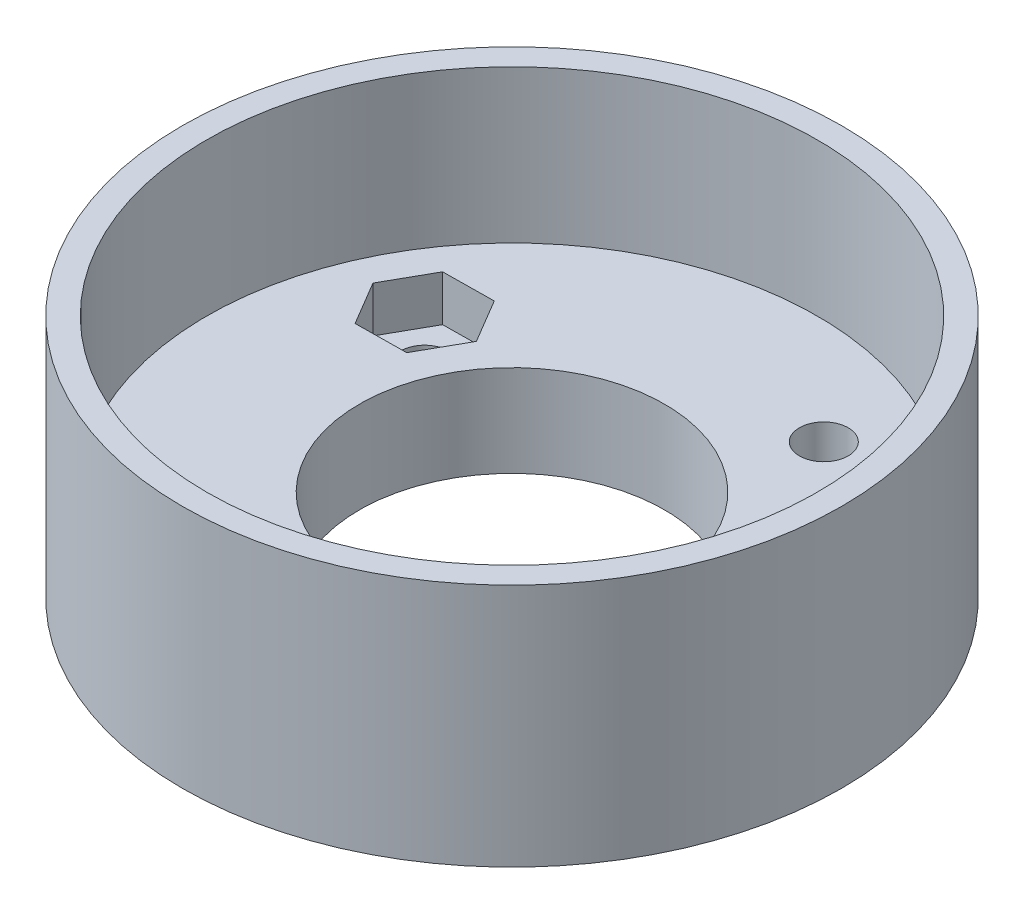
from build123d import *

# Parameters (mm, degrees)
SKETCH1_R           = 21.6
SKETCH1_R_2         = 20
BOSS_EXTRUDE1_DEPTH = 10
BOSS_EXTRUDE2_START = -6
SKETCH1_3_R         = 21.6
SKETCH1_3_R_2       = 20
SKETCH1_3_R_3       = 10
SKETCH1_3_R_4       = 1.6
BOSS_EXTRUDE2_DEPTH = 6
SKETCH1_5_R         = 1.6
CUT_EXTRUDE2_DEPTH  = 33.14218412
CUT_EXTRUDE1_START  = -6
CUT_EXTRUDE1_DEPTH  = 3
BOSS_EXTRUDE3_START = -2.8
SKETCH1_6_R         = 1.6
BOSS_EXTRUDE3_DEPTH = 0.2
CIRPATTERN2_COUNT   = 2
SKETCH3_R           = 1.6
CUT_EXTRUDE4_DEPTH  = 33.14218412
SKETCH3_3_R         = 1.6
CUT_EXTRUDE5_DEPTH  = 3
CIRPATTERN3_COUNT   = 2


with BuildPart() as part:
    # Sketch1 → Boss-Extrude1 (new body)
    with BuildSketch(Plane(origin=(0, 0, 0), x_dir=(1, 0, 0), z_dir=(0, 1, 0))):
        with Locations(Location((0, 0, 0), (0, 0, 270))):
            Circle(SKETCH1_R)
        with Locations(Location((0, 0, 0), (0, 0, 270))):
            Circle(SKETCH1_R_2, mode=Mode.SUBTRACT)
    extrude(amount=BOSS_EXTRUDE1_DEPTH)

    # Sketch1<3> → Boss-Extrude2 (add)
    # profile 1 of 4: a face of its own
    with BuildSketch(Plane(origin=(0, 0, 0), x_dir=(1, 0, 0), z_dir=(0, 1, 0)).offset(BOSS_EXTRUDE2_START)):
        with Locations(Location((0, 0, 0), (0, 0, 270))):
            Circle(SKETCH1_3_R)
        with Locations(Location((0, 0, 0), (0, 0, 270))):
            Circle(SKETCH1_3_R_2, mode=Mode.SUBTRACT)
    # profile 2 of 4: a face of its own
    with BuildSketch(Plane(origin=(0, 0, 0), x_dir=(1, 0, 0), z_dir=(0, 1, 0)).offset(BOSS_EXTRUDE2_START)):
        with Locations(Location((0, 0, 0), (0, 0, 270))):
            Circle(SKETCH1_3_R_2)
        with Locations(Location((0, 0, 0), (0, 0, 270))):
            Circle(SKETCH1_3_R_3, mode=Mode.SUBTRACT)
        Polygon((10.271761873, 11.432595565), (10.234009445, 14.78101431), (7.315317535, 16.42252912), (4.434378054, 14.715625186), (4.472130483, 11.367206441), (7.390822392, 9.725691631), align=None, mode=Mode.SUBTRACT)
    # profile 3 of 4: a face of its own
    with BuildSketch(Plane(origin=(0, 0, 0), x_dir=(1, 0, 0), z_dir=(0, 1, 0)).offset(BOSS_EXTRUDE2_START)):
        Polygon((7.390822392, 9.725691631), (10.271761873, 11.432595565), (10.234009445, 14.78101431), (7.315317535, 16.42252912), (4.434378054, 14.715625186), (4.472130483, 11.367206441), align=None)
        with Locations((7.353069964, 13.074110375)):
            Circle(SKETCH1_3_R_4, mode=Mode.SUBTRACT)
    # profile 4 of 4: a face of its own
    with BuildSketch(Plane(origin=(0, 0, 0), x_dir=(1, 0, 0), z_dir=(0, 1, 0)).offset(BOSS_EXTRUDE2_START)):
        with Locations((7.353069964, 13.074110375)):
            Circle(SKETCH1_3_R_4)
    extrude(amount=BOSS_EXTRUDE2_DEPTH)

    # Sketch1<5> → Cut-Extrude2 (cut, through all)
    with BuildSketch(Plane(origin=(0, 0, 0), x_dir=(1, 0, 0), z_dir=(0, 1, 0))):
        with Locations(Location((7.353069964, 13.074110375, 0), (0, 0, 270))):
            Circle(SKETCH1_5_R)
    cut_extrude2 = extrude(amount=-CUT_EXTRUDE2_DEPTH, mode=Mode.SUBTRACT)

    # Sketch1<4> → Cut-Extrude1 (cut)
    with BuildSketch(Plane(origin=(0, 0, 0), x_dir=(1, 0, 0), z_dir=(0, 1, 0)).offset(CUT_EXTRUDE1_START)):
        Polygon((10.234009445, 14.78101431), (7.315317535, 16.42252912), (4.434378054, 14.715625186), (4.472130483, 11.367206441), (7.390822392, 9.725691631), (10.271761873, 11.432595565), align=None)
    cut_extrude1 = extrude(amount=CUT_EXTRUDE1_DEPTH, mode=Mode.SUBTRACT)

    # Sketch1<6> → Boss-Extrude3 (add)
    with BuildSketch(Plane(origin=(0, 0, 0), x_dir=(1, 0, 0), z_dir=(0, 1, 0)).offset(BOSS_EXTRUDE3_START)):
        with Locations(Location((7.353069964, 13.074110375, 0), (0, 0, 270))):
            Circle(SKETCH1_6_R)
    boss_extrude3 = extrude(amount=-BOSS_EXTRUDE3_DEPTH)

    # CirPattern2: Cut-Extrude2, Cut-Extrude1, Boss-Extrude3 ×2 about axis
    cirpattern2_axis = Axis((0, 0, 0), (0, 1, 0))
    add([cut_extrude2.rotate(cirpattern2_axis, i * 360 / CIRPATTERN2_COUNT) for i in range(1, CIRPATTERN2_COUNT)], mode=Mode.SUBTRACT)
    add([cut_extrude1.rotate(cirpattern2_axis, i * 360 / CIRPATTERN2_COUNT) for i in range(1, CIRPATTERN2_COUNT)], mode=Mode.SUBTRACT)
    add([boss_extrude3.rotate(cirpattern2_axis, i * 360 / CIRPATTERN2_COUNT) for i in range(1, CIRPATTERN2_COUNT)])

    # Sketch3 → Cut-Extrude4 (cut, through all)
    with BuildSketch(Plane(origin=(0, 0, 0), x_dir=(1, 0, 0), z_dir=(0, 1, 0))):
        with Locations(Location((13.074110375, -7.353069964, 0), (0, 0, 270))):
            Circle(SKETCH3_R)
    cut_extrude4 = extrude(amount=-CUT_EXTRUDE4_DEPTH, mode=Mode.SUBTRACT)

    # Sketch3<3> → Cut-Extrude5 (cut)
    with BuildSketch(Plane(origin=(0, 0, 0), x_dir=(1, 0, 0), z_dir=(0, 1, 0))):
        Polygon((14.715625186, -4.434378054), (11.367206441, -4.472130483), (9.725691631, -7.390822392), (11.432595565, -10.271761873), (14.78101431, -10.234009445), (16.42252912, -7.315317535), align=None)
        with Locations(Location((13.074110375, -7.353069964, 0), (0, 0, 270))):
            Circle(SKETCH3_3_R, mode=Mode.SUBTRACT)
    cut_extrude5 = extrude(amount=-CUT_EXTRUDE5_DEPTH, mode=Mode.SUBTRACT)

    # CirPattern3: Cut-Extrude4, Cut-Extrude5 ×2 about axis
    cirpattern3_axis = Axis((0, 0, 0), (0, 1, 0))
    add([cut_extrude4.rotate(cirpattern3_axis, i * 360 / CIRPATTERN3_COUNT) for i in range(1, CIRPATTERN3_COUNT)], mode=Mode.SUBTRACT)
    add([cut_extrude5.rotate(cirpattern3_axis, i * 360 / CIRPATTERN3_COUNT) for i in range(1, CIRPATTERN3_COUNT)], mode=Mode.SUBTRACT)


solid = part.part
